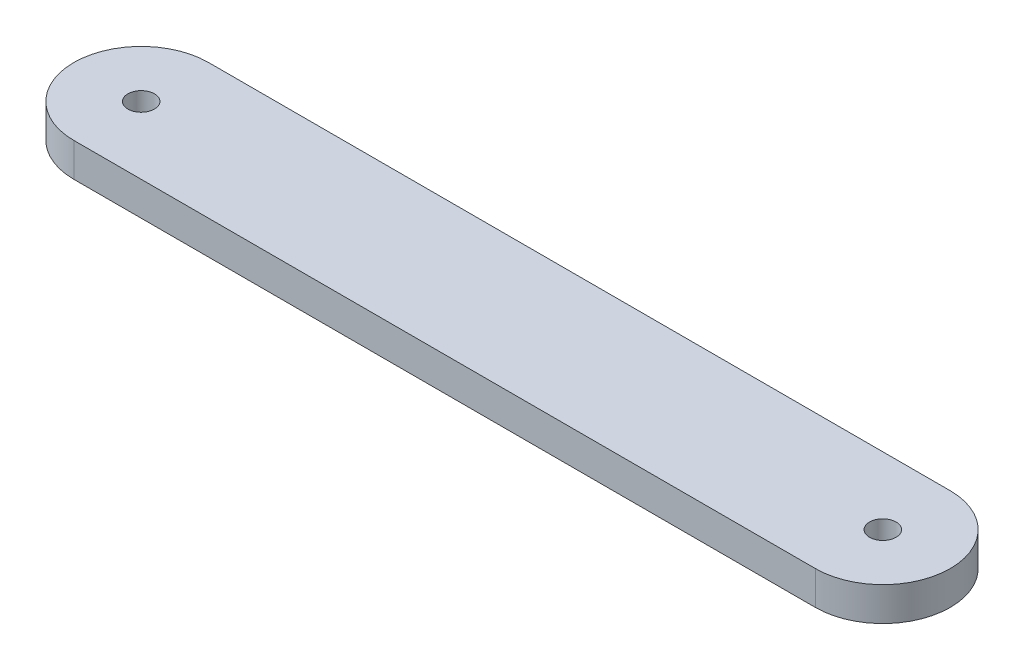
from build123d import *

# Parameters (mm, degrees)
BOSS_EXTRUDE1_DEPTH = 6.35
SKETCH3_R           = 2.499999953
CUT_EXTRUDE1_DEPTH  = 6.35
LPATTERN1_COUNT     = 2
LPATTERN1_PITCH     = 139.7


with BuildPart() as part:
    # Sketch1 → Boss-Extrude1 (new body)
    with BuildSketch(Plane(origin=(0, 0, 0), x_dir=(1, 0, 0), z_dir=(0, 1, 0))):
        with BuildLine():
            Line((0, 12.7), (139.7, 12.7))
            ThreePointArc((139.7, 12.7), (152.4, 0), (139.7, -12.7))
            Line((139.7, -12.7), (0, -12.7))
            ThreePointArc((0, -12.7), (-12.7, 0), (0, 12.7))
        make_face()
    extrude(amount=BOSS_EXTRUDE1_DEPTH)

    # Sketch3 → Cut-Extrude1 (cut)
    with BuildSketch(Plane(origin=(0, 6.35, 0), x_dir=(1, 0, 0), z_dir=(0, 1, 0))):
        with Locations(Location((0, 0, 0), (0, 0, 270))):
            Circle(SKETCH3_R)
    cut_extrude1 = extrude(amount=-CUT_EXTRUDE1_DEPTH, mode=Mode.SUBTRACT)

    # LPattern1: Cut-Extrude1 ×2
    with Locations(*[(i * LPATTERN1_PITCH, 0, 0) for i in range(1, LPATTERN1_COUNT)]):
        add(cut_extrude1, mode=Mode.SUBTRACT)


solid = part.part
